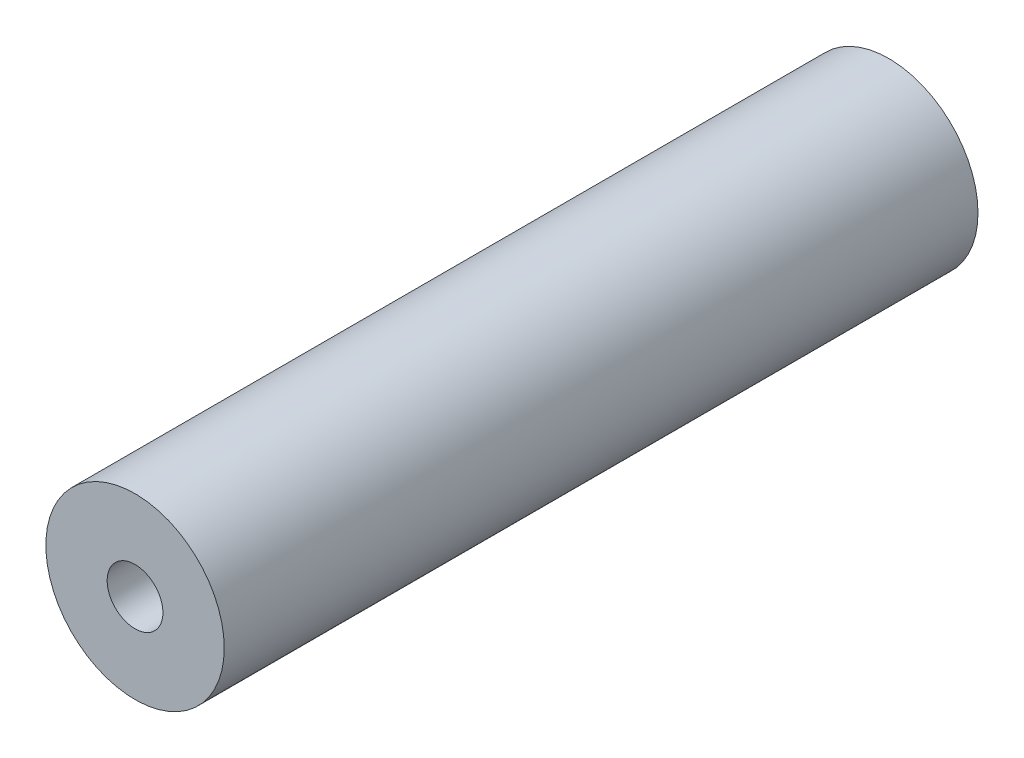
from build123d import *

# Parameters (mm, degrees)
SKETCH1_R               = 4
BOSS_EXTRUDE1_DEPTH     = 33.8
TAP_DRILL_FOR_M3_TAP1_D = 2.5


with BuildPart() as part:
    # Sketch1 → Boss-Extrude1 (new body)
    with BuildSketch(Plane.XY):
        Circle(SKETCH1_R)
    extrude(amount=BOSS_EXTRUDE1_DEPTH)

    # Tap Drill for M3 Tap1 (through all)
    with Locations(Plane.XY.offset(33.8)):
        with Locations((0, 0)):
            Hole(TAP_DRILL_FOR_M3_TAP1_D / 2)


solid = part.part
